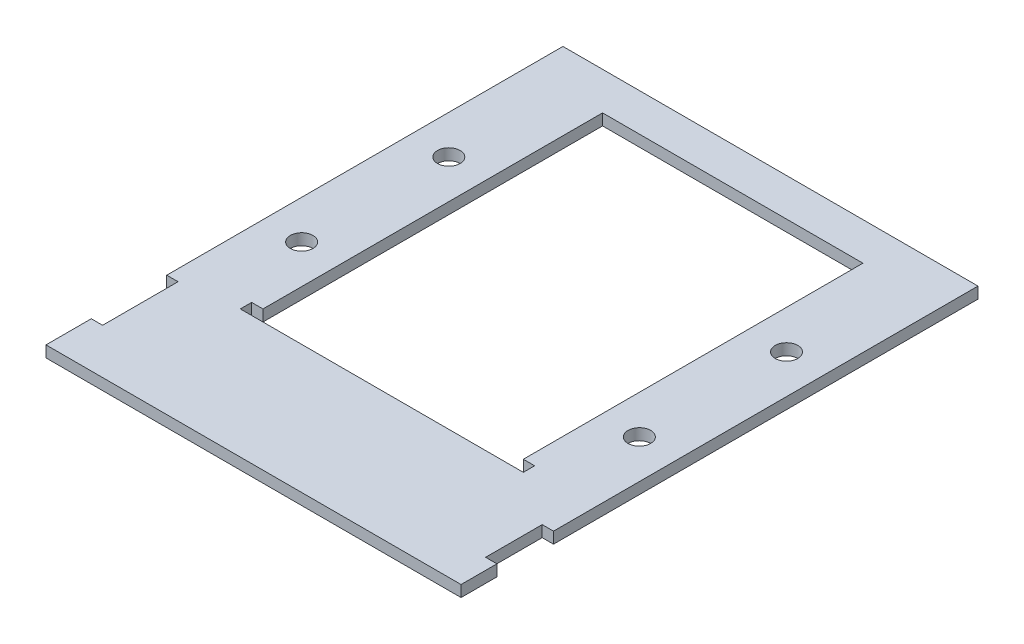
from build123d import *

# Parameters (mm, degrees)
CROQUIS1_R              = 3
SALIENTE_EXTRUIR1_DEPTH = 3


with BuildPart() as part:
    # Croquis1 → Saliente-Extruir1 (new body)
    with BuildSketch(Plane(origin=(0, 0, 0), x_dir=(1, 0, 0), z_dir=(0, 1, 0))):
        Polygon((0, 3), (110, 3), (110, 12.5), (107, 12.5), (107, 20), (107, 27.5), (110, 27.5), (110, 37), (110, 140), (89.5, 140), (20.5, 140), (0, 140), (0, 50), (0, 35), (3, 35), (3, 20), (3, 15), (0, 15), align=None)
        with Locations(Location((10.25, 60.5, 0), (0, 0, 270))):
            Circle(CROQUIS1_R, mode=Mode.SUBTRACT)
        with Locations(Location((99.75, 60.5, 0), (0, 0, 270))):
            Circle(CROQUIS1_R, mode=Mode.SUBTRACT)
        with Locations(Location((10.25, 99.5, 0), (0, 0, 270))):
            Circle(CROQUIS1_R, mode=Mode.SUBTRACT)
        Polygon((92.5, 37), (89.5, 37), (20.5, 37), (17.5, 37), (17.5, 40), (20.5, 40), (20.5, 130), (89.5, 130), (89.5, 40), (92.5, 40), align=None, mode=Mode.SUBTRACT)
        with Locations(Location((99.75, 99.5, 0), (0, 0, 270))):
            Circle(CROQUIS1_R, mode=Mode.SUBTRACT)
    extrude(amount=SALIENTE_EXTRUIR1_DEPTH)


solid = part.part
